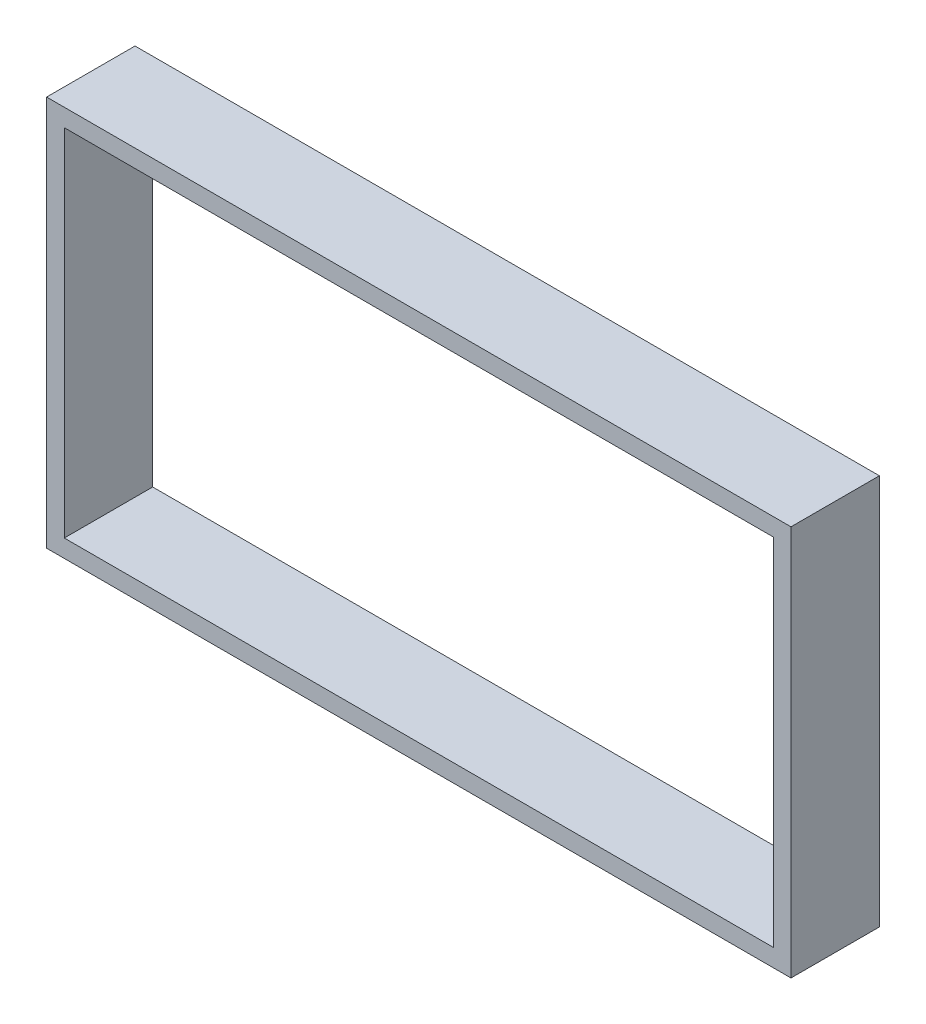
from build123d import *

# Parameters (mm, degrees)
SKETCH_1_W      = 84.2
SKETCH_1_H      = 44.2
SKETCH_1_W_2    = 80.2
SKETCH_1_H_2    = 40.2
EXTRUDE_1_DEPTH = 10


with BuildPart() as part:
    # 草图1 → 凸台-拉伸1 (new body)
    with BuildSketch(Plane.XY):
        with Locations((-5.172727273, -8.354545455)):
            Rectangle(SKETCH_1_W, SKETCH_1_H)
        with Locations((-5.172727273, -8.354545455)):
            Rectangle(SKETCH_1_W_2, SKETCH_1_H_2, mode=Mode.SUBTRACT)
    extrude(amount=EXTRUDE_1_DEPTH)


solid = part.part
